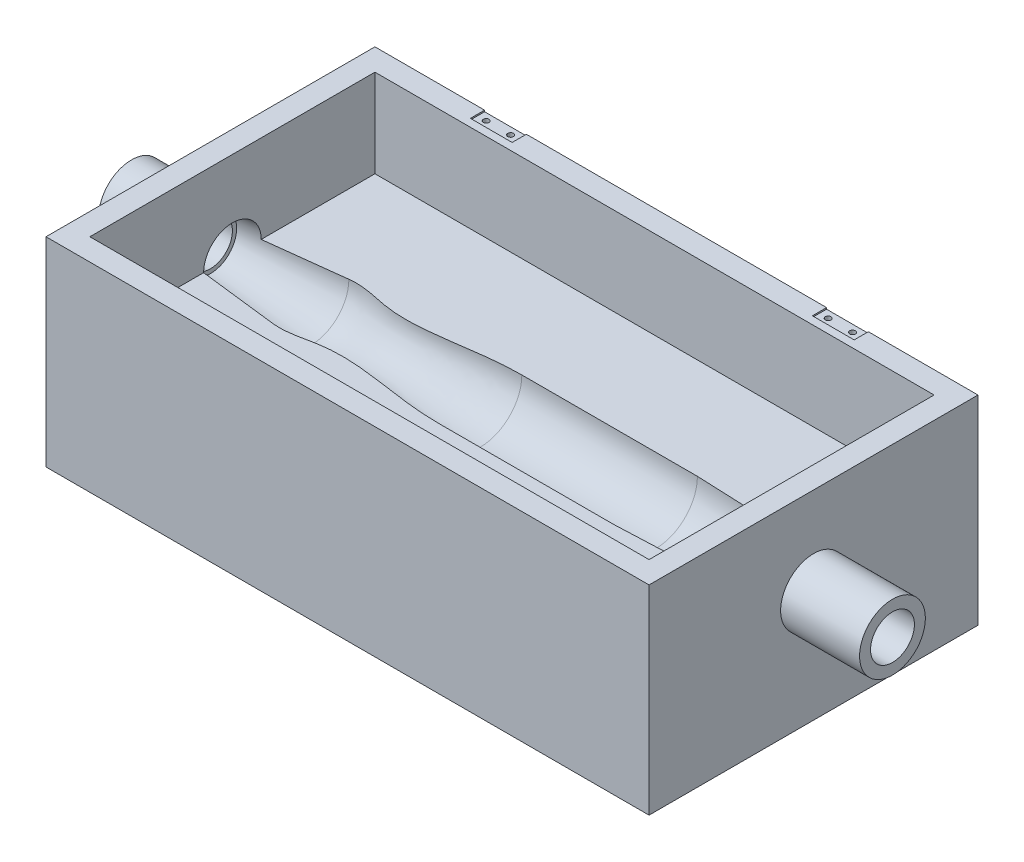
from build123d import *

# Parameters (mm, degrees)
BOSS_EXTRUDE1_DEPTH      = 75
BOSS_EXTRUDE1_DEPTH_BACK = 75
SKETCH2_W                = 275
SKETCH2_H                = 50.8
SKETCH4_W                = 275
SKETCH4_H                = 150
SKETCH4_W_2              = 255
SKETCH4_H_2              = 130
BOSS_EXTRUDE4_DEPTH      = 40.132
SKETCH3_R                = 15
SKETCH3_R_2              = 10
BOSS_EXTRUDE2_DEPTH      = 36
SKETCH5_W                = 19.05
SKETCH5_H                = 6.48
CUT_EXTRUDE1_DEPTH       = 0.64
M2_CLEARANCE_HOLE1_D     = 2.6
M2_CLEARANCE_HOLE1_DEPTH = 2
M2_CLEARANCE_HOLE1_TIP   = 0.781118805


with BuildPart() as part:
    # Sketch2 → Boss-Extrude1 (new, two sides: drawn at the far end of the back side and taken through both)
    with BuildSketch(Plane.XY.offset(-BOSS_EXTRUDE1_DEPTH_BACK)):
        with Locations((0, -25.4)):
            Rectangle(SKETCH2_W, SKETCH2_H)
    extrude(amount=BOSS_EXTRUDE1_DEPTH + BOSS_EXTRUDE1_DEPTH_BACK)

    # Sketch4 → Boss-Extrude4 (add)
    with BuildSketch(Plane(origin=(0, 0, 0), x_dir=(1, 0, 0), z_dir=(0, 1, 0))):
        Rectangle(SKETCH4_W, SKETCH4_H)
        Rectangle(SKETCH4_W_2, SKETCH4_H_2, mode=Mode.SUBTRACT)
    extrude(amount=BOSS_EXTRUDE4_DEPTH)

    # Sketch1 → Cut-Revolve1 (revolve, cut)
    with BuildSketch(Plane.XY):
        with BuildLine():
            Line((-137.5, 0), (137.5, 0))
            Line((137.5, 0), (137.5, 7.747))
            add(Edge.make_bspline(
                [(119.602, 16.764), (126.446685513, 16.474787936), (132.251729161, 15.730759902), (137.5, 12.322795174), (137.5, 7.747)],
                knots=[0, 0, 0, 0, 0.656247862, 1, 1, 1, 1], degree=3))
            Line((119.602, 16.764), (65.5, 19.05))
            Line((65.5, 19.05), (-14.564, 19.05))
            add(Edge.make_bspline(
                [(-91.78, 17.399), (-84.901336541, 18.220618135), (-60.549292723, 10.012805319), (-35.82944709, 19.05), (-14.564, 19.05)],
                knots=[0, 0, 0, 0, 0.244238151, 1, 1, 1, 1], degree=3))
            Line((-91.78, 17.399), (-137.5, 11.938))
            Line((-137.5, 11.938), (-137.5, 0))
        make_face()
    revolve(axis=Axis((-137.5, 0, 0), (1, 0, 0)), mode=Mode.SUBTRACT)

    # Sketch3 → Boss-Extrude2 (add)
    with BuildSketch(Plane(origin=(137.5, 0, 0), x_dir=(0, 0, -1), z_dir=(1, 0, 0))):
        Circle(SKETCH3_R)
        Circle(SKETCH3_R_2, mode=Mode.SUBTRACT)
    boss_extrude2 = extrude(amount=BOSS_EXTRUDE2_DEPTH)

    # Mirror1: Boss-Extrude2 across plane
    add(boss_extrude2.mirror(Plane(origin=(0, 0, 0), x_dir=(0, 0, 1), z_dir=(1, 0, 0))))

    # Sketch5 → Cut-Extrude1 (cut)
    with BuildSketch(Plane(origin=(0, 40.132, 0), x_dir=(1, 0, 0), z_dir=(0, 1, 0))):
        with Locations((-77.975, 71.76)):
            Rectangle(SKETCH5_W, SKETCH5_H)
        with Locations((77.975, 71.76)):
            Rectangle(SKETCH5_W, SKETCH5_H)
    extrude(amount=-CUT_EXTRUDE1_DEPTH, mode=Mode.SUBTRACT)

    # M2 Clearance Hole1
    with Locations(Plane(origin=(0, 39.492, 0), x_dir=(1, 0, 0), z_dir=(0, 1, 0))):
        with Locations((-83.54, 71.76), (-72.41, 71.76), (72.41, 71.76), (83.54, 71.76)):
            Hole(M2_CLEARANCE_HOLE1_D / 2, depth=M2_CLEARANCE_HOLE1_DEPTH)
            with Locations((0, 0, -(M2_CLEARANCE_HOLE1_DEPTH + M2_CLEARANCE_HOLE1_TIP / 2))):  # 118° drill point
                Cone(0, M2_CLEARANCE_HOLE1_D / 2, M2_CLEARANCE_HOLE1_TIP, mode=Mode.SUBTRACT)


solid = part.part
